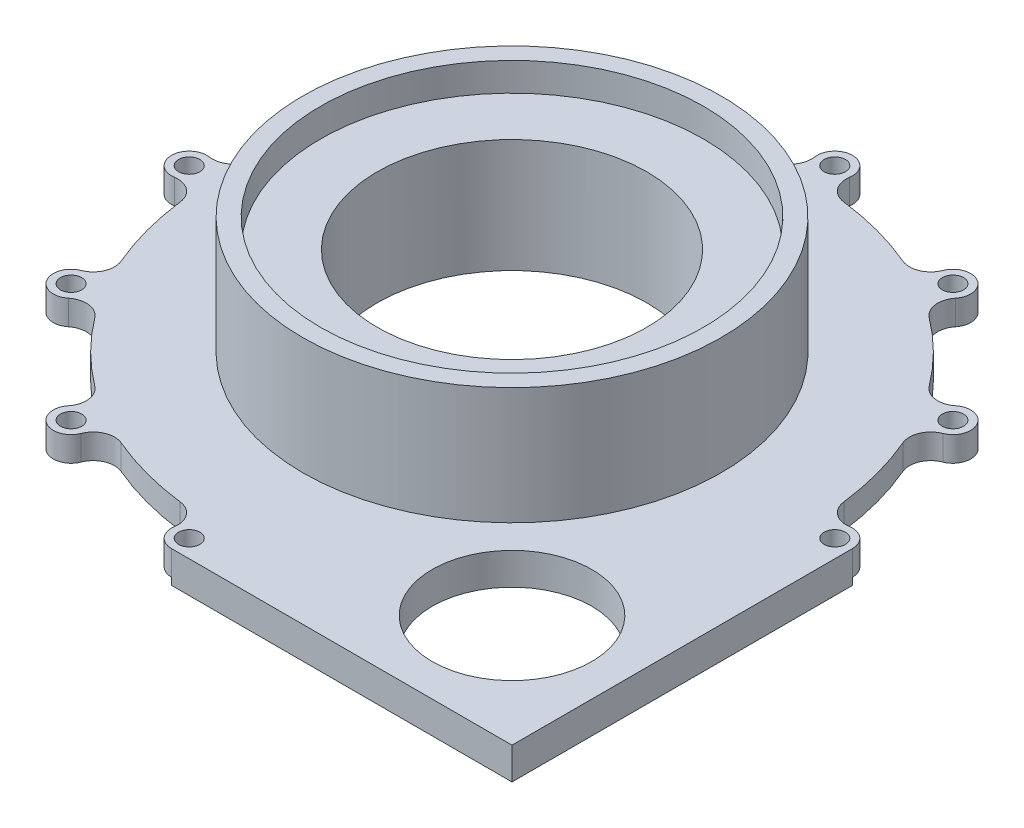
from build123d import *

# Parameters (mm, degrees)
HOLE1_D             = 76
HOLE1_CBORE_D       = 94
HOLE1_CBORE_DEPTH   = 2
HOLE2_D             = 66
HOLE2_DEPTH         = 42
HOLE2_CBORE_D       = 108
HOLE2_CBORE_DEPTH   = 8
CUT_EXTRUDE1_DEPTH  = 2
FILLET1_R           = 5
SKETCH7_R           = 3
BOSS_EXTRUDE1_DEPTH = 7
CIRPATTERN1_COUNT   = 12
BOSS_EXTRUDE2_DEPTH = 9
HOLE3_D             = 45


with BuildPart() as part:
    # Sketch1 → Revolve1 (revolve)
    with BuildSketch(Plane.XY, mode=Mode.PRIVATE) as revolve1_sk:
        Polygon((0, 0), (-80, 0), (-80, 2), (-84, 2), (-84, 9), (-59, 9), (-59, 42), (0, 42), align=None)
    revolve(revolve1_sk.sketch.rotate(Axis((0, 42, 0), (0, -1, 0)), 270), axis=Axis((0, 42, 0), (0, -1, 0)))

    # Hole1 (through all)
    with Locations(Plane(origin=(0, 0, 0), x_dir=(-1, 0, 0), z_dir=(0, -1, 0))):
        with Locations((0, 0)):
            CounterBoreHole(HOLE1_D / 2, HOLE1_CBORE_D / 2, HOLE1_CBORE_DEPTH)

    # Hole2
    with Locations(Plane(origin=(0, 42, 0), x_dir=(1, 0, 0), z_dir=(0, 1, 0))):
        with Locations((0, 0)):
            CounterBoreHole(HOLE2_D / 2, HOLE2_CBORE_D / 2, HOLE2_CBORE_DEPTH, depth=HOLE2_DEPTH)

    # Sketch6 → Cut-Extrude1 (cut)
    with BuildSketch(Plane.XZ):
        with BuildLine():
            Line((49.959984, 2), (76.974022, 2))
            ThreePointArc((76.974022, 2), (74.376289, 19.929066), (67.661458, 36.75496))
            Line((67.661458, 36.75496), (44.266615, 23.247941))
            ThreePointArc((44.266615, 23.247941), (48.296291, 12.940952), (49.959984, 2))
        make_face()
        with BuildLine():
            Line((49.959984, -2), (76.974022, -2))
            ThreePointArc((76.974022, -2), (74.376289, -19.929066), (67.661458, -36.75496))
            Line((67.661458, -36.75496), (44.266615, -23.247941))
            ThreePointArc((44.266615, -23.247941), (48.296291, -12.940952), (49.959984, -2))
        make_face()
        with BuildLine():
            Line((42.266615, -26.712043), (65.661458, -40.219062))
            ThreePointArc((65.661458, -40.219062), (54.447222, -54.447222), (40.219062, -65.661458))
            Line((40.219062, -65.661458), (26.712043, -42.266615))
            ThreePointArc((26.712043, -42.266615), (35.355339, -35.355339), (42.266615, -26.712043))
        make_face()
        with BuildLine():
            Line((23.247941, -44.266615), (36.75496, -67.661458))
            ThreePointArc((36.75496, -67.661458), (19.929066, -74.376289), (2, -76.974022))
            Line((2, -76.974022), (2, -49.959984))
            ThreePointArc((2, -49.959984), (12.940952, -48.296291), (23.247941, -44.266615))
        make_face()
        with BuildLine():
            Line((-2, -49.959984), (-2, -76.974022))
            ThreePointArc((-2, -76.974022), (-19.929066, -74.376289), (-36.75496, -67.661458))
            Line((-36.75496, -67.661458), (-23.247941, -44.266615))
            ThreePointArc((-23.247941, -44.266615), (-12.940952, -48.296291), (-2, -49.959984))
        make_face()
        with BuildLine():
            Line((-26.712043, -42.266615), (-40.219062, -65.661458))
            ThreePointArc((-40.219062, -65.661458), (-54.447222, -54.447222), (-65.661458, -40.219062))
            Line((-65.661458, -40.219062), (-42.266615, -26.712043))
            ThreePointArc((-42.266615, -26.712043), (-35.355339, -35.355339), (-26.712043, -42.266615))
        make_face()
        with BuildLine():
            Line((-44.266615, -23.247941), (-67.661458, -36.75496))
            ThreePointArc((-67.661458, -36.75496), (-74.376289, -19.929066), (-76.974022, -2))
            Line((-76.974022, -2), (-49.959984, -2))
            ThreePointArc((-49.959984, -2), (-48.296291, -12.940952), (-44.266615, -23.247941))
        make_face()
        with BuildLine():
            Line((-49.959984, 2), (-76.974022, 2))
            ThreePointArc((-76.974022, 2), (-74.376289, 19.929066), (-67.661458, 36.75496))
            Line((-67.661458, 36.75496), (-44.266615, 23.247941))
            ThreePointArc((-44.266615, 23.247941), (-48.296291, 12.940952), (-49.959984, 2))
        make_face()
        with BuildLine():
            Line((-42.266615, 26.712043), (-65.661458, 40.219062))
            ThreePointArc((-65.661458, 40.219062), (-54.447222, 54.447222), (-40.219062, 65.661458))
            Line((-40.219062, 65.661458), (-26.712043, 42.266615))
            ThreePointArc((-26.712043, 42.266615), (-35.355339, 35.355339), (-42.266615, 26.712043))
        make_face()
        with BuildLine():
            Line((-23.247941, 44.266615), (-36.75496, 67.661458))
            ThreePointArc((-36.75496, 67.661458), (-19.929066, 74.376289), (-2, 76.974022))
            Line((-2, 76.974022), (-2, 49.959984))
            ThreePointArc((-2, 49.959984), (-12.940952, 48.296291), (-23.247941, 44.266615))
        make_face()
        with BuildLine():
            Line((2, 49.959984), (2, 76.974022))
            ThreePointArc((2, 76.974022), (19.929066, 74.376289), (36.75496, 67.661458))
            Line((36.75496, 67.661458), (23.247941, 44.266615))
            ThreePointArc((23.247941, 44.266615), (12.940952, 48.296291), (2, 49.959984))
        make_face()
        with BuildLine():
            Line((26.712043, 42.266615), (40.219062, 65.661458))
            ThreePointArc((40.219062, 65.661458), (54.447222, 54.447222), (65.661458, 40.219062))
            Line((65.661458, 40.219062), (42.266615, 26.712043))
            ThreePointArc((42.266615, 26.712043), (35.355339, 35.355339), (26.712043, 42.266615))
        make_face()
    extrude(amount=-CUT_EXTRUDE1_DEPTH, mode=Mode.SUBTRACT)

    # Fillet1
    fillet1_edges = [part.edges().sort_by_distance(p)[0] for p in [
        (2, 1, -49.959984),
        (23.247941, 1, -44.266615),
        (-2, 1, -76.974022),
        (-36.75496, 1, -67.661458),
        (-23.247941, 1, -44.266615),
        (-2, 1, -49.959984),
        (40.219062, 1, 65.661458),
        (65.661458, 1, 40.219062),
        (42.266615, 1, 26.712043),
        (26.712043, 1, 42.266615),
        (2, 1, 76.974022),
        (36.75496, 1, 67.661458),
        (23.247941, 1, 44.266615),
        (2, 1, 49.959984),
        (-36.75496, 1, 67.661458),
        (-2, 1, 76.974022),
        (-2, 1, 49.959984),
        (-23.247941, 1, 44.266615),
        (76.974022, 1, -2),
        (67.661458, 1, -36.75496),
        (44.266615, 1, -23.247941),
        (49.959984, 1, -2),
        (-76.974022, 1, 2),
        (-67.661458, 1, 36.75496),
        (-44.266615, 1, 23.247941),
        (-49.959984, 1, 2),
        (-65.661458, 1, 40.219062),
        (-40.219062, 1, 65.661458),
        (-26.712043, 1, 42.266615),
        (-42.266615, 1, 26.712043),
        (-40.219062, 1, -65.661458),
        (-65.661458, 1, -40.219062),
        (-42.266615, 1, -26.712043),
        (-26.712043, 1, -42.266615),
        (-67.661458, 1, -36.75496),
        (-76.974022, 1, -2),
        (-49.959984, 1, -2),
        (-44.266615, 1, -23.247941),
        (67.661458, 1, 36.75496),
        (76.974022, 1, 2),
        (49.959984, 1, 2),
        (44.266615, 1, 23.247941),
        (65.661458, 1, -40.219062),
        (40.219062, 1, -65.661458),
        (26.712043, 1, -42.266615),
        (42.266615, 1, -26.712043),
        (36.75496, 1, -67.661458),
        (2, 1, -76.974022),
    ]]
    fillet(fillet1_edges, radius=FILLET1_R)

    # Sketch7 → Boss-Extrude1 (add)
    with BuildSketch(Plane(origin=(0, 9, 0), x_dir=(1, 0, 0), z_dir=(0, 1, 0))):
        with BuildLine():
            ThreePointArc((90.245754, -4.942784), (96, 0), (90.245754, 4.942784))
            ThreePointArc((90.245754, 4.942784), (85.713723, 6.094446), (83.384615, 10.149183))
            ThreePointArc((83.384615, 10.149183), (84, 0), (83.384615, -10.149183))
            ThreePointArc((83.384615, -10.149183), (85.713723, -6.094446), (90.245754, -4.942784))
        make_face()
        with Locations(Location((91, 0, 0), (0, 0, 270))):
            Circle(SKETCH7_R, mode=Mode.SUBTRACT)
    boss_extrude1 = extrude(amount=-BOSS_EXTRUDE1_DEPTH)

    # CirPattern1: Boss-Extrude1 ×12 about axis
    cirpattern1_axis = Axis((0, 0, 0), (0, 1, 0))
    for i in range(1, CIRPATTERN1_COUNT):
        add(boss_extrude1.rotate(cirpattern1_axis, i * 360 / CIRPATTERN1_COUNT))

    # Sketch9 → Boss-Extrude2 (add)
    with BuildSketch(Plane(origin=(0, 9, 0), x_dir=(1, 0, 0), z_dir=(0, 1, 0))):
        with BuildLine():
            Line((96, 0), (96, -96))
            Line((96, -96), (0, -96))
            Line((0, -96), (0, -94))
            ThreePointArc((0, -94), (3, -91), (0, -88))
            Line((0, -88), (0, -38))
            ThreePointArc((0, -38), (26.870058, -26.870058), (38, 0))
            Line((38, 0), (88, 0))
            ThreePointArc((88, 0), (91, -3), (94, 0))
            Line((94, 0), (96, 0))
        make_face()
    extrude(amount=-BOSS_EXTRUDE2_DEPTH)

    # Hole3 (through all)
    with Locations(Plane(origin=(0, 9, 0), x_dir=(1, 0, 0), z_dir=(0, 1, 0))):
        with Locations((64.346717, -64.346717)):
            Hole(HOLE3_D / 2)


solid = part.part
